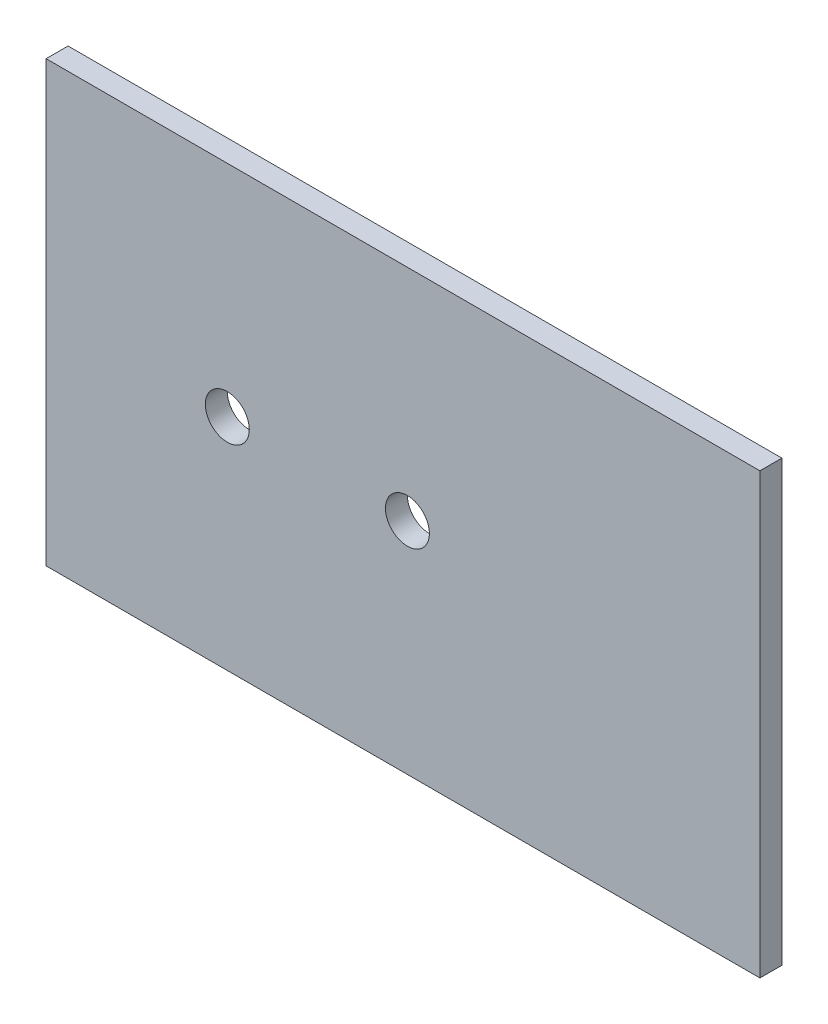
from build123d import *

# Parameters (mm, degrees)
ESBO_O1_W                = 65
ESBO_O1_H                = 40
RESSALTO_EXTRUS_O1_DEPTH = 2
ESBO_O2_R                = 2
CORTE_EXTRUS_O1_DEPTH    = 52.602644659


with BuildPart() as part:
    # Esboço1 → Ressalto-extrusão1 (new body)
    with BuildSketch(Plane.XY):
        with Locations((-2.88188746, 17.509398496)):
            Rectangle(ESBO_O1_W, ESBO_O1_H)
    extrude(amount=RESSALTO_EXTRUS_O1_DEPTH)

    # Esboço2 → Corte-extrusão1 (cut, through all)
    with BuildSketch(Plane.XY.offset(2)):
        with Locations((-18.88188746, 17.509398496)):
            Circle(ESBO_O2_R)
        with Locations((-2.48188746, 17.509398496)):
            Circle(ESBO_O2_R)
    extrude(amount=-CORTE_EXTRUS_O1_DEPTH, mode=Mode.SUBTRACT)


solid = part.part
